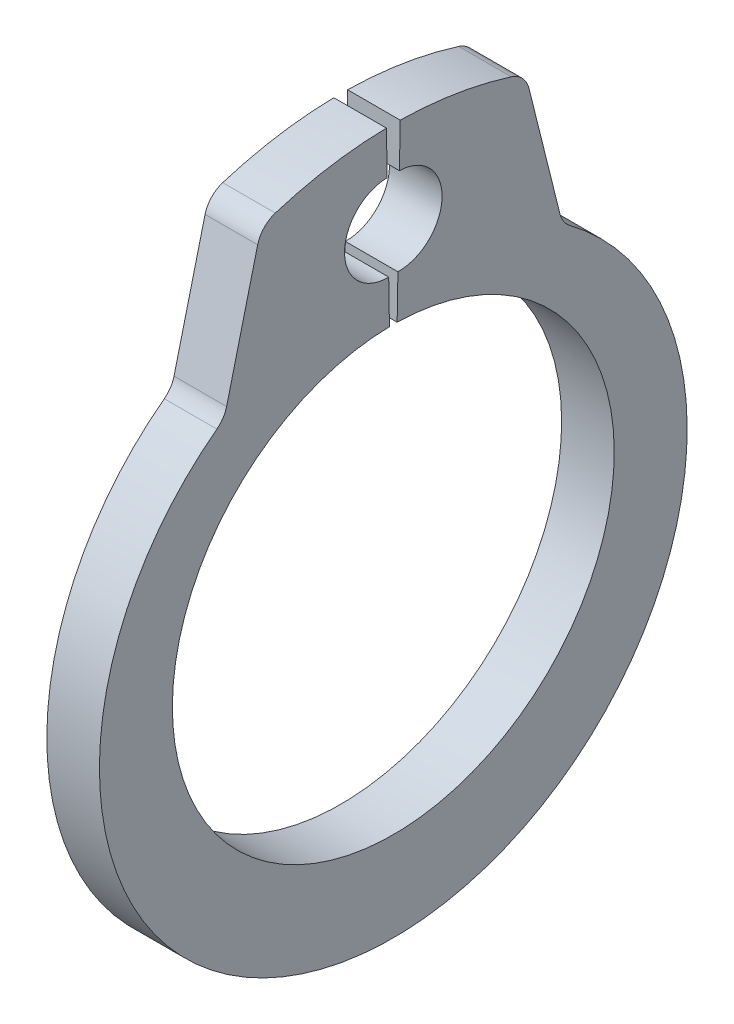
from build123d import *

# Parameters (mm, degrees)
EXTRUDE1_DEPTH = 0.5
FILLET1_R      = 0.5


with BuildPart() as part:
    # Sketch1 → Extrude1 (new, symmetric)
    with BuildSketch(Plane(origin=(0, 0, 0), x_dir=(0, 0, -1), z_dir=(1, 0, 0))):
        with BuildLine():
            Line((0.073300107, 4.19936032), (0.087698342, 5.024234668))
            ThreePointArc((0.087698342, 5.024234668), (0.926970926, 5.834710781), (0.116494813, 6.673983365))
            Line((0.116494813, 6.673983365), (0.130893048, 7.498857714))
            ThreePointArc((0.130893048, 7.498857714), (1.339135991, 7.379479304), (2.512285186, 7.066712329))
            Line((2.512285186, 7.066712329), (3.212819738, 4.257021702))
            ThreePointArc((3.212819738, 4.257021702), (0, -5.9), (-3.212819738, 4.257021702))
            Line((-3.212819738, 4.257021702), (-2.512285186, 7.066712329))
            ThreePointArc((-2.512285186, 7.066712329), (-1.339135991, 7.379479304), (-0.130893048, 7.498857714))
            Line((-0.130893048, 7.498857714), (-0.116494813, 6.673983365))
            ThreePointArc((-0.116494813, 6.673983365), (-0.926970926, 5.834710781), (-0.087698342, 5.024234668))
            Line((-0.087698342, 5.024234668), (-0.073300107, 4.19936032))
            ThreePointArc((-0.073300107, 4.19936032), (0, -4.2), (0.073300107, 4.19936032))
        make_face()
    extrude(amount=EXTRUDE1_DEPTH, both=True)

    # Fillet1
    fillet1_edges = [part.edges().sort_by_distance(p)[0] for p in [
        (0, 7.066712329, -2.512285186),
        (0, 4.257021702, -3.212819738),
        (0, 4.257021702, 3.212819738),
        (0, 7.066712329, 2.512285186),
    ]]
    fillet(fillet1_edges, radius=FILLET1_R)


solid = part.part
